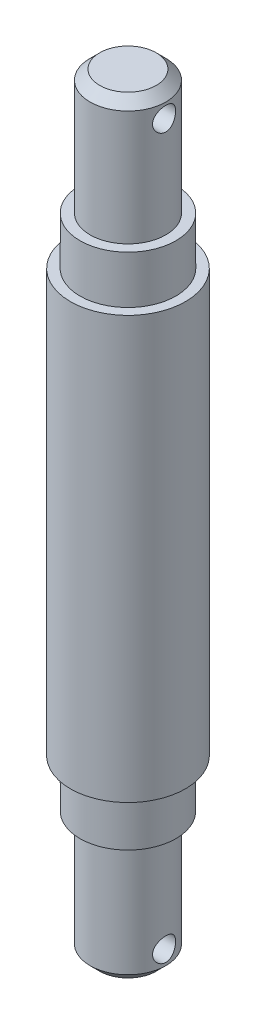
from build123d import *

# Parameters (mm, degrees)
ESBO_O1_R                     = 6
RESSALTO_EXTRUS_O1_DEPTH      = 44
RESSALTO_EXTRUS_O3_DEPTH      = 5
RESSALTO_EXTRUS_O3_DEPTH_BACK = 49
ESBO_O2_R                     = 5
RESSALTO_EXTRUS_O4_DEPTH      = 13
RESSALTO_EXTRUS_O4_DEPTH_BACK = 67
ESBO_O3_R                     = 3.95
CHANFRO1_SIZE                 = 1
CHANFRO2_SIZE                 = 1
CORTE_EXTRUS_O1_DEPTH         = 63.577951389
CORTE_EXTRUS_O1_DEPTH_BACK    = 63.577951389
ESBO_O5_R                     = 1.2
CORTE_EXTRUS_O2_DEPTH         = 63.577951389
CORTE_EXTRUS_O2_DEPTH_BACK    = 63.577951389
ESBO_O6_R                     = 1.2


with BuildPart() as part:
    # Esboço1 → Ressalto-extrusão1 (new body)
    with BuildSketch(Plane(origin=(0, 0, 0), x_dir=(1, 0, 0), z_dir=(0, 1, 0))):
        with Locations(Location((0, 0, 0), (0, 0, 270))):
            Circle(ESBO_O1_R)
    extrude(amount=RESSALTO_EXTRUS_O1_DEPTH)

    # Esboço2 → Ressalto-extrusão3 (add, two sides: drawn at the far end of the back side and taken through both)
    with BuildSketch(Plane(origin=(0, 0, 0), x_dir=(-1, 0, 0), z_dir=(0, -1, 0)).offset(-RESSALTO_EXTRUS_O3_DEPTH_BACK)):
        with Locations(Location((0, 0, 0), (0, 0, 270))):
            Circle(ESBO_O2_R)
    extrude(amount=RESSALTO_EXTRUS_O3_DEPTH + RESSALTO_EXTRUS_O3_DEPTH_BACK)

    # Esboço3 → Ressalto-extrusão4 (add, two sides: drawn at the far end of the back side and taken through both)
    with BuildSketch(Plane(origin=(0, 49, 0), x_dir=(1, 0, 0), z_dir=(0, 1, 0)).offset(-RESSALTO_EXTRUS_O4_DEPTH_BACK)):
        with Locations(Location((0, 0, 0), (0, 0, 270))):
            Circle(ESBO_O3_R)
    extrude(amount=RESSALTO_EXTRUS_O4_DEPTH + RESSALTO_EXTRUS_O4_DEPTH_BACK)

    # Chanfro1
    chanfro1_edges = [part.edges().sort_by_distance(p)[0] for p in [
        (0, 62, -3.95),
    ]]
    chamfer(chanfro1_edges, length=CHANFRO1_SIZE)

    # Chanfro2
    chanfro2_edges = [part.edges().sort_by_distance(p)[0] for p in [
        (0, -18, -3.95),
    ]]
    chamfer(chanfro2_edges, length=CHANFRO2_SIZE)

    # Esboço5 → Corte-extrusão1 (cut, two sides: drawn at the far end of the back side and taken through both)
    with BuildSketch(Plane(origin=(0, 0, 0), x_dir=(0, 0, -1), z_dir=(1, 0, 0)).offset(-CORTE_EXTRUS_O1_DEPTH_BACK)):
        with Locations((0, 59.5)):
            Circle(ESBO_O5_R)
    extrude(amount=CORTE_EXTRUS_O1_DEPTH + CORTE_EXTRUS_O1_DEPTH_BACK, mode=Mode.SUBTRACT)

    # Esboço6 → Corte-extrusão2 (cut, two sides: drawn at the far end of the back side and taken through both)
    with BuildSketch(Plane(origin=(0, 0, 0), x_dir=(0, 0, -1), z_dir=(1, 0, 0)).offset(-CORTE_EXTRUS_O2_DEPTH_BACK)):
        with Locations((0, -15.5)):
            Circle(ESBO_O6_R)
    extrude(amount=CORTE_EXTRUS_O2_DEPTH + CORTE_EXTRUS_O2_DEPTH_BACK, mode=Mode.SUBTRACT)


solid = part.part
